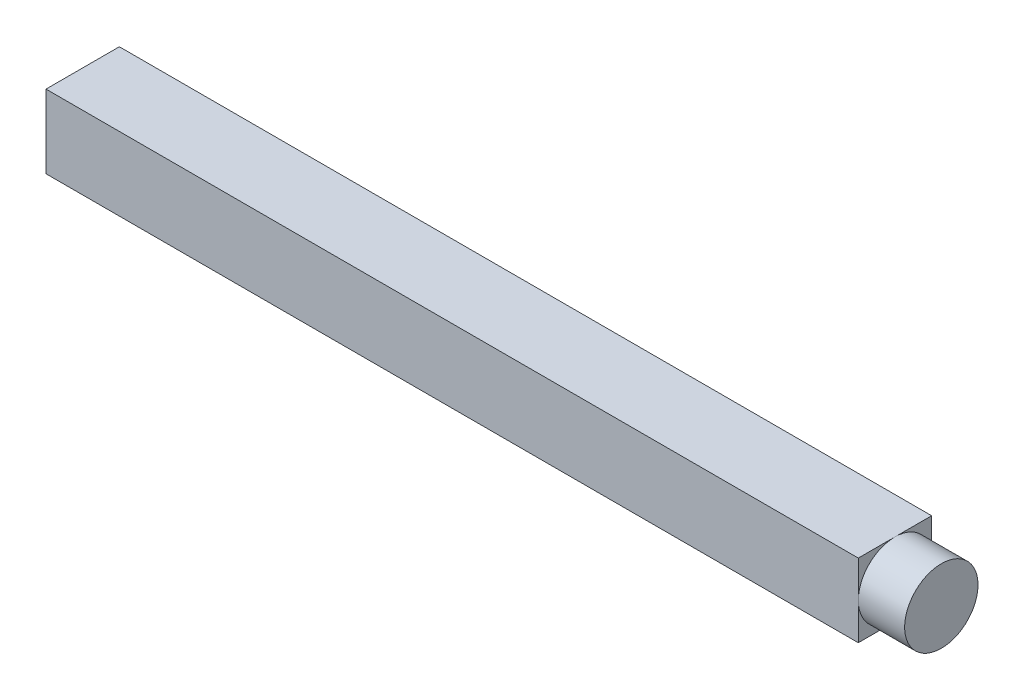
from build123d import *

# Parameters (mm, degrees)
SKETCH1_W           = 6.35
SKETCH1_H           = 6.35
BOSS_EXTRUDE1_DEPTH = 74.3375
CUT_EXTRUDE1_START  = -4.0132
SKETCH2_W           = 6.604
SKETCH2_H           = 6.604
SKETCH2_R           = 3.175
CUT_EXTRUDE1_DEPTH  = 4.0132


with BuildPart() as part:
    # Sketch1 → Boss-Extrude1 (new body)
    with BuildSketch(Plane(origin=(0, 0, 0), x_dir=(0, 0, -1), z_dir=(1, 0, 0))):
        Rectangle(SKETCH1_W, SKETCH1_H)
    extrude(amount=BOSS_EXTRUDE1_DEPTH)

    # Sketch2 → Cut-Extrude1 (cut)
    with BuildSketch(Plane(origin=(74.3375, 0, 0), x_dir=(0, 0, -1), z_dir=(1, 0, 0)).offset(CUT_EXTRUDE1_START)):
        Rectangle(SKETCH2_W, SKETCH2_H)
        Circle(SKETCH2_R, mode=Mode.SUBTRACT)
    extrude(amount=CUT_EXTRUDE1_DEPTH, mode=Mode.SUBTRACT)


solid = part.part
